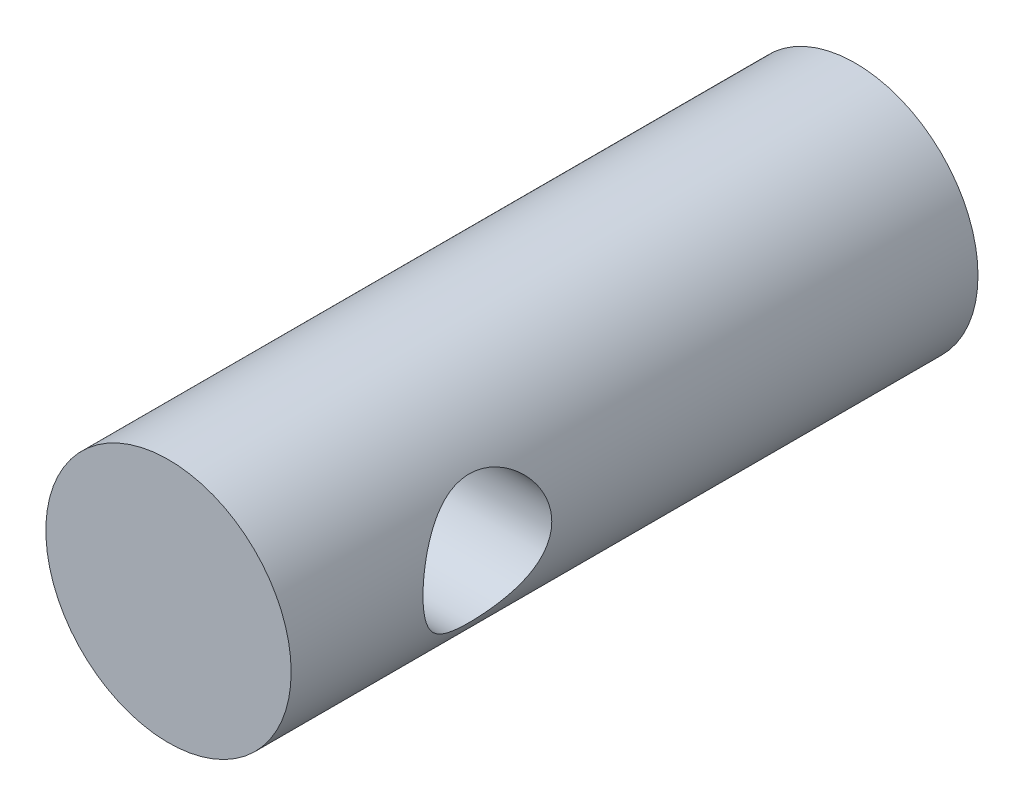
from build123d import *

# Parameters (mm, degrees)
IZIM1_R                     = 10
Y_KSEKLIK_EKSTR_ZYON1_DEPTH = 56
KES_EKSTR_ZYON2_DEPTH       = 58.758116313
KES_EKSTR_ZYON2_DEPTH_BACK  = 58.758116313
IZIM2_R                     = 5.25


with BuildPart() as part:
    # Çizim1 → Yükseklik-Ekstrüzyon1 (new body)
    with BuildSketch(Plane.XY):
        Circle(IZIM1_R)
    extrude(amount=Y_KSEKLIK_EKSTR_ZYON1_DEPTH)

    # Çizim2 → Kes-Ekstrüzyon2 (cut, two sides: drawn at the far end of the back side and taken through both)
    with BuildSketch(Plane(origin=(0, 0, 0), x_dir=(0, 0, -1), z_dir=(1, 0, 0)).offset(-KES_EKSTR_ZYON2_DEPTH_BACK)):
        with Locations((-40, 0)):
            Circle(IZIM2_R)
    extrude(amount=KES_EKSTR_ZYON2_DEPTH + KES_EKSTR_ZYON2_DEPTH_BACK, mode=Mode.SUBTRACT)


solid = part.part
